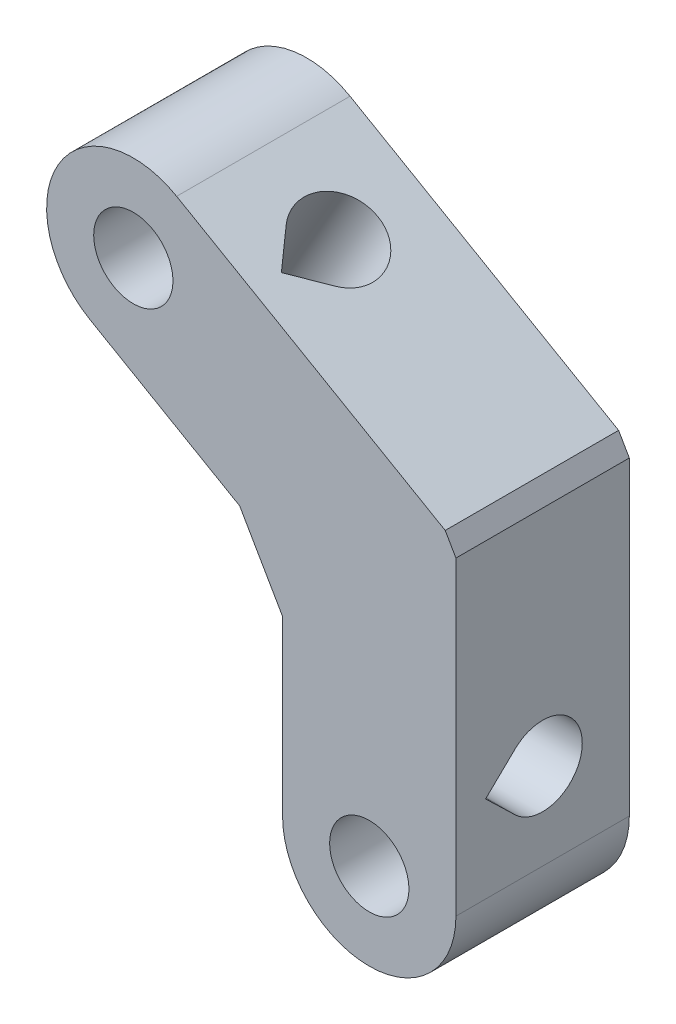
from build123d import *

# Parameters (mm, degrees)
BOSS_EXTRUDE1_DEPTH = 14
CUT_EXTRUDE1_DEPTH  = 46.814563472
CUT_EXTRUDE2_DEPTH  = 47.465040622
HOLE1_D             = 6.4
HOLE2_D             = 6.4


with BuildPart() as part:
    # Sketch1 → Boss-Extrude1 (new body)
    with BuildSketch(Plane.XY.offset(14)):
        with BuildLine():
            Line((7, 0), (7, 25.041451884))
            Line((7, 25.041451884), (6.133974596, 26.541451884))
            Line((6.133974596, 26.541451884), (-15.552558883, 39.062177826))
            ThreePointArc((-15.552558883, 39.062177826), (-25.11473671, 36.5), (-22.552558883, 26.937822174))
            Line((-22.552558883, 26.937822174), (-10.464101615, 19.958548116))
            Line((-10.464101615, 19.958548116), (-7, 13.958548116))
            Line((-7, 13.958548116), (-7, 0))
            ThreePointArc((-7, 0), (0, -7), (7, 0))
        make_face()
    extrude(amount=-BOSS_EXTRUDE1_DEPTH)

    # Sketch2 → Cut-Extrude1 (cut, through all)
    with BuildSketch(Plane(origin=(6.026279442, 10.437822174, 0), x_dir=(0.8660254037844398, -0.49999999999999806, 0), z_dir=(-0.499999999999998, -0.8660254037844397, 0))):
        with BuildLine():
            Line((-26, 11.606580927), (-28.301887361, 9.222906785))
            ThreePointArc((-28.301887361, 9.222906785), (-26, 3.8), (-23.698112639, 9.222906785))
            Line((-23.698112639, 9.222906785), (-26, 11.606580927))
        make_face()
    extrude(amount=-CUT_EXTRUDE1_DEPTH, mode=Mode.SUBTRACT)

    # Sketch3 → Cut-Extrude2 (cut, through all)
    with BuildSketch(Plane.ZY.offset(7)):
        with BuildLine():
            Line((9.222906785, 4.698112639), (11.606580927, 7))
            Line((11.606580927, 7), (9.222906785, 9.301887361))
            ThreePointArc((9.222906785, 9.301887361), (3.8, 7), (9.222906785, 4.698112639))
        make_face()
    extrude(amount=-CUT_EXTRUDE2_DEPTH, mode=Mode.SUBTRACT)

    # Hole1 (through all)
    with Locations(Plane(origin=(0, 0, 0), x_dir=(-1, 0, 0), z_dir=(0, 0, -1))):
        with Locations((0, 0)):
            Hole(HOLE1_D / 2)

    # Hole2 (through all)
    with Locations(Plane(origin=(0, 0, 0), x_dir=(-1, 0, 0), z_dir=(0, 0, -1))):
        with Locations((19.0525, 32.999898011)):
            Hole(HOLE2_D / 2)


solid = part.part
